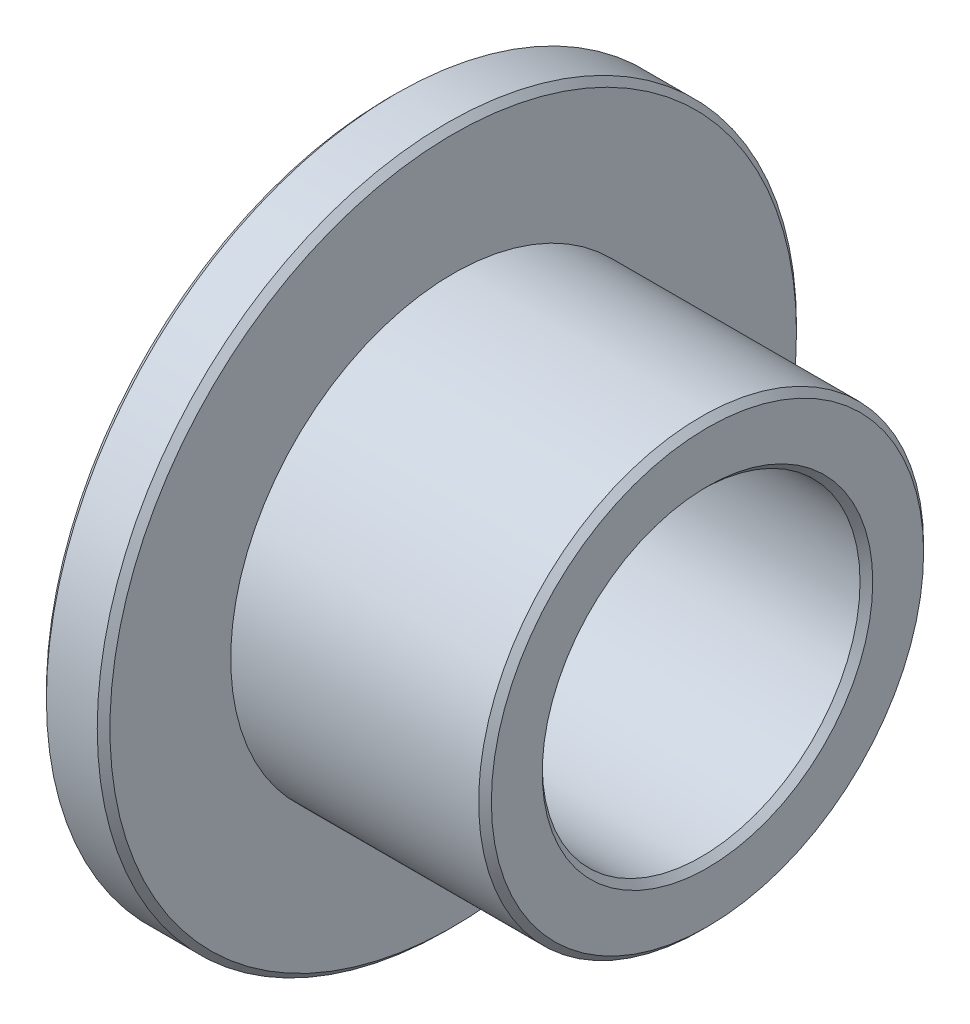
from build123d import *

# Parameters (mm, degrees)
SKETCH_1_R          = 11
EXTRUDE_1_DEPTH     = 2
SKETCH_2_R          = 7
EXTRUDE_2_DEPTH     = 8
SKETCH_3_R          = 5
CUT_EXTRUDE_1_DEPTH = 19.493242009
CHAMFER_1_SIZE      = 0.2


with BuildPart() as part:
    # 草图1 → 凸台-拉伸1 (new body)
    with BuildSketch(Plane(origin=(0, 0, 0), x_dir=(0, 0, -1), z_dir=(1, 0, 0))):
        Circle(SKETCH_1_R)
    extrude(amount=EXTRUDE_1_DEPTH)

    # 草图2 → 凸台-拉伸2 (add)
    with BuildSketch(Plane(origin=(2, 0, 0), x_dir=(0, 0, -1), z_dir=(1, 0, 0))):
        Circle(SKETCH_2_R)
    extrude(amount=EXTRUDE_2_DEPTH)

    # 草图3 → 切除-拉伸1 (cut, through all)
    with BuildSketch(Plane(origin=(10, 0, 0), x_dir=(0, 0, -1), z_dir=(1, 0, 0))):
        Circle(SKETCH_3_R)
    extrude(amount=-CUT_EXTRUDE_1_DEPTH, mode=Mode.SUBTRACT)

    # 倒角1
    chamfer_1_edges = [part.edges().sort_by_distance(p)[0] for p in [
        (0, 0, 5),
        (10, 0, 5),
        (0, 0, 11),
        (2, 0, 11),
        (10, 0, 7),
    ]]
    chamfer(chamfer_1_edges, length=CHAMFER_1_SIZE)


solid = part.part
